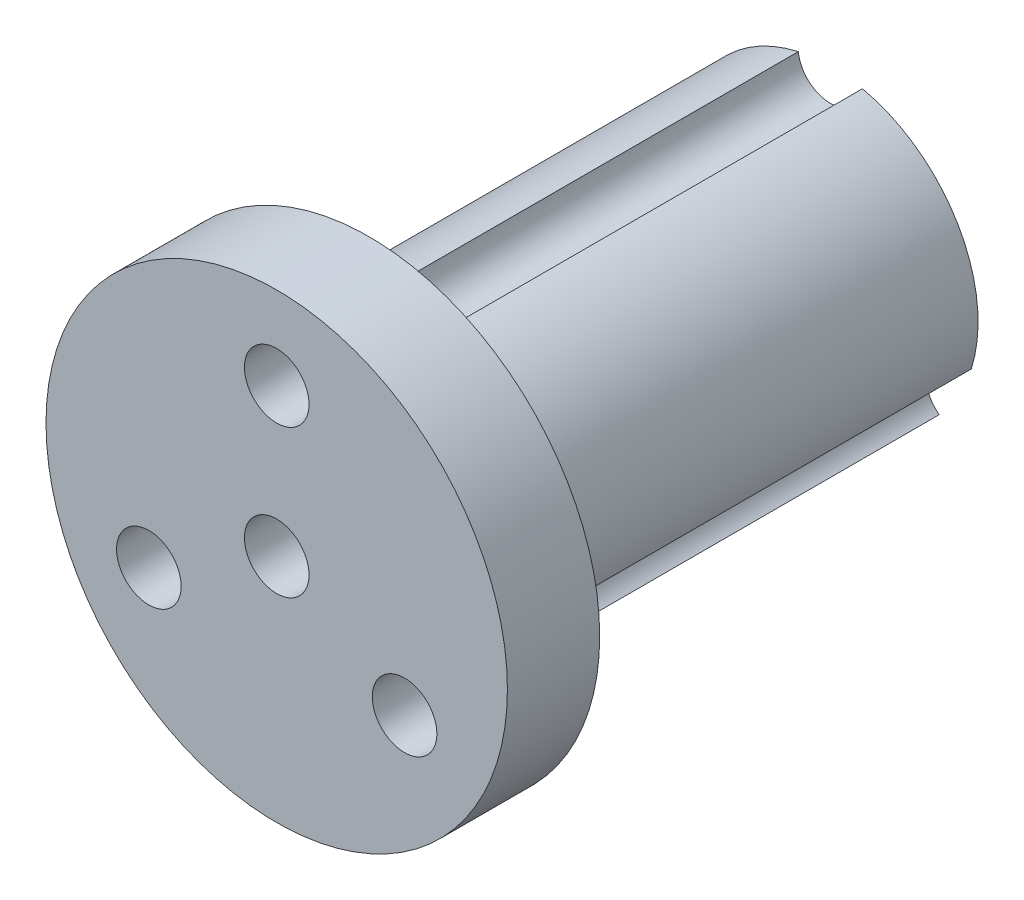
from build123d import *

# Parameters (mm, degrees)
SKETCH_1_R          = 8
EXTRUDE_1_DEPTH     = 25
SKETCH_2_R          = 12.5
EXTRUDE_2_DEPTH     = 5
SKETCH_3_R          = 1.75
CUT_EXTRUDE_1_DEPTH = 38


with BuildPart() as part:
    # 草图1 → 凸台-拉伸1 (new body)
    with BuildSketch(Plane.XY):
        Circle(SKETCH_1_R)
    extrude(amount=EXTRUDE_1_DEPTH)

    # 草图2 → 凸台-拉伸2 (add)
    with BuildSketch(Plane.XY.offset(25)):
        Circle(SKETCH_2_R)
    extrude(amount=EXTRUDE_2_DEPTH)

    # 草图3 → 切除-拉伸1 (cut)
    with BuildSketch(Plane.XY.offset(30)):
        Circle(SKETCH_3_R)
        with Locations((0, 8)):
            Circle(SKETCH_3_R)
        with Locations((-6.92820323, -4)):
            Circle(SKETCH_3_R)
        with Locations((6.92820323, -4)):
            Circle(SKETCH_3_R)
    extrude(amount=-CUT_EXTRUDE_1_DEPTH, mode=Mode.SUBTRACT)


solid = part.part
